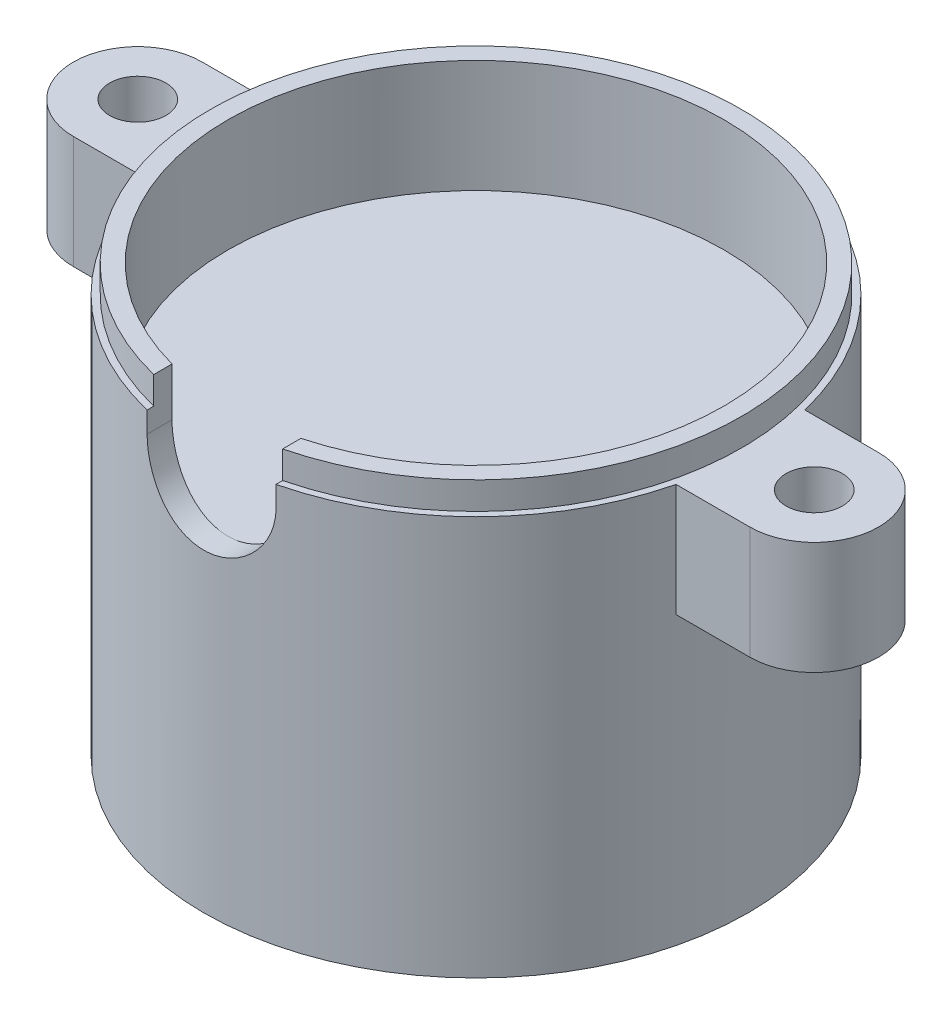
from build123d import *

# Parameters (mm, degrees)
CUT_EXTRUDE1_DEPTH  = 10
SKETCH4_R           = 1.75
BOSS_EXTRUDE1_DEPTH = 7
CUT_EXTRUDE2_DEPTH  = 3


with BuildPart() as part:
    # Sketch1 → Revolve1 (revolve)
    with BuildSketch(Plane.XY, mode=Mode.PRIVATE) as revolve1_sk:
        Polygon((0, 12), (15.4, 12), (15.4, 0), (16.9, 0), (16.9, 24.8), (16.5, 24.8), (16.5, 26.5), (15.4, 26.5), (15.4, 19.5), (0, 19.5), align=None)
    revolve(revolve1_sk.sketch.rotate(Axis((0, 0, 0), (0, 1, 0)), 90), axis=Axis((0, 0, 0), (0, 1, 0)))

    # Sketch3 → Cut-Extrude1 (cut)
    with BuildSketch(Plane.XY.offset(16.9)):
        with BuildLine():
            Line((-4, 26.5), (-4, 23.5))
            ThreePointArc((-4, 23.5), (0, 19.5), (4, 23.5))
            Line((4, 23.5), (4, 26.5))
            Line((4, 26.5), (-4, 26.5))
        make_face()
    extrude(amount=-CUT_EXTRUDE1_DEPTH, mode=Mode.SUBTRACT)

    # Sketch4 → Boss-Extrude1 (add)
    with BuildSketch(Plane(origin=(0, 24.8, 0), x_dir=(1, 0, 0), z_dir=(0, 1, 0))):
        with BuildLine():
            Line((21, -4), (16.419805115, -4))
            ThreePointArc((16.419805115, -4), (16.9, 0), (16.419805115, 4))
            Line((16.419805115, 4), (21, 4))
            ThreePointArc((21, 4), (25, 0), (21, -4))
        make_face()
        with Locations(Location((21, 0, 0), (0, 0, 270))):
            Circle(SKETCH4_R, mode=Mode.SUBTRACT)
    boss_extrude1 = extrude(amount=-BOSS_EXTRUDE1_DEPTH)

    # Sketch5 → Cut-Extrude2 (cut)
    with BuildSketch(Plane.XZ.offset(-17.8)):
        Polygon((18.35, -1.529978213), (21, -3.059956427), (23.65, -1.529978213), (23.65, 1.529978213), (21, 3.059956427), (18.35, 1.529978213), align=None)
    cut_extrude2 = extrude(amount=-CUT_EXTRUDE2_DEPTH, mode=Mode.SUBTRACT)

    # Mirror1: Boss-Extrude1, Cut-Extrude2 across plane
    add(boss_extrude1.mirror(Plane(origin=(0, 0, 0), x_dir=(0, 0, 1), z_dir=(1, 0, 0))))
    add(cut_extrude2.mirror(Plane(origin=(0, 0, 0), x_dir=(0, 0, 1), z_dir=(1, 0, 0))), mode=Mode.SUBTRACT)


solid = part.part
